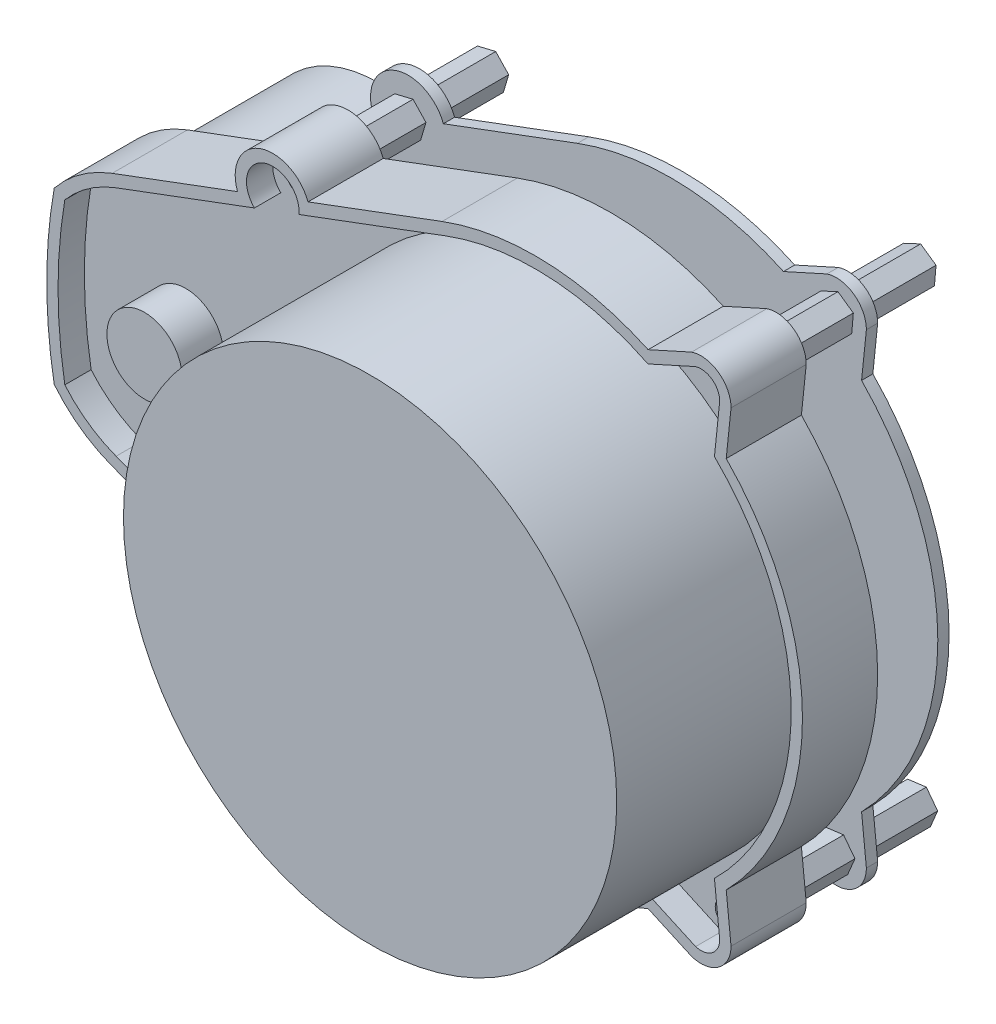
from build123d import *

# Parameters (mm, degrees)
ESQUISSE1_R             = 1.6
BOSS_EXTRU_1_DEPTH      = 10
ESQUISSE2_R             = 32.8
BOSS_EXTRU_2_DEPTH      = 22
ENL_V_MAT_EXTRU_1_DEPTH = 3.5
BOSS_EXTRU_3_REACH      = 79.261
ESQUISSE4_R             = 32.8
ESQUISSE5_R             = 16
BOSS_EXTRU_4_DEPTH      = 19
ESQUISSE6_R             = 1
BOSS_EXTRU_5_DEPTH      = 27
BOSS_EXTRU_6_DEPTH      = 1.5
ESQUISSE8_R             = 5
BOSS_EXTRU_7_DEPTH      = 5.5
SKETCH_1_W              = 183.813547174
SKETCH_1_H              = 124.067416174
CUT_EXTRUDE_1_DEPTH     = 18


with BuildPart() as part:
    # Esquisse1 → Boss.-Extru.1 (new body)
    with BuildSketch(Plane.XY):
        with BuildLine():
            ThreePointArc((-56.3, -16.861494596), (-60.528670487, -14.599558136), (-64.01, -11.301322931))
            ThreePointArc((-64.01, -11.301322931), (-65, 0), (-64.01, 11.301322931))
            ThreePointArc((-64.01, 11.301322931), (-60.528670487, 14.599558136), (-56.3, 16.861494596))
            Line((-56.3, 16.861494596), (-39.624688626, 23.091930519))
            ThreePointArc((-39.624688626, 23.091930519), (-36.690940127, 29.525679018), (-30.257191628, 26.591930519))
            Line((-30.257191628, 26.591930519), (-12.425, 33.254614341))
            ThreePointArc((-12.425, 33.254614341), (1.381675102, 35.473102119), (14.973963383, 32.187426436))
            Line((14.973963383, 32.187426436), (20.756023105, 34.801647207))
            ThreePointArc((20.756023105, 34.801647207), (24.347774736, 34.238511045), (26, 31))
            Line((26, 31), (25.359978077, 24.841930519))
            ThreePointArc((25.359978077, 24.841930519), (35.5, 0), (25.359978077, -24.841930519))
            Line((25.359978077, -24.841930519), (26, -31))
            ThreePointArc((26, -31), (24.347774736, -34.238511045), (20.756023105, -34.801647207))
            Line((20.756023105, -34.801647207), (14.973963383, -32.187426436))
            ThreePointArc((14.973963383, -32.187426436), (1.381675102, -35.473102119), (-12.425, -33.254614341))
            Line((-12.425, -33.254614341), (-30.257191628, -26.591930519))
            ThreePointArc((-30.257191628, -26.591930519), (-36.690940127, -29.525679018), (-39.624688626, -23.091930519))
            Line((-39.624688626, -23.091930519), (-56.3, -16.861494596))
        make_face()
        with Locations((-35, -25)):
            Circle(ESQUISSE1_R, mode=Mode.SUBTRACT)
        with Locations((22, 31)):
            Circle(ESQUISSE1_R, mode=Mode.SUBTRACT)
        with Locations((-35, 25)):
            Circle(ESQUISSE1_R, mode=Mode.SUBTRACT)
        with Locations((22, -31)):
            Circle(ESQUISSE1_R, mode=Mode.SUBTRACT)
    extrude(amount=BOSS_EXTRU_1_DEPTH)

    # Esquisse2 → Boss.-Extru.2 (add)
    with BuildSketch(Plane.XY.offset(10)):
        Circle(ESQUISSE2_R)
    extrude(amount=BOSS_EXTRU_2_DEPTH)

    # Esquisse3 → Enlèv. mat.-Extru.1 (cut)
    with BuildSketch(Plane.XY.offset(10)):
        with BuildLine():
            Line((-55.775, -15.456370046), (-37.378202776, -22.330008789))
            ThreePointArc((-37.378202776, -22.330008789), (-36.165940127, -28.120554469), (-31.453677478, -24.543603151))
            Line((-31.453677478, -24.543603151), (-11.9, -31.849489792))
            ThreePointArc((-11.9, -31.849489792), (1.664031028, -33.959255009), (14.956816294, -30.533484019))
            Line((14.956816294, -30.533484019), (21.291141631, -33.397398551))
            ThreePointArc((21.291141631, -33.397398551), (23.468656713, -33.023128137), (24.499056843, -31.06866508))
            Line((24.499056843, -31.06866508), (23.79417774, -24.286562245))
            ThreePointArc((23.79417774, -24.286562245), (34, 0), (23.79417774, 24.286562245))
            Line((23.79417774, 24.286562245), (24.499056843, 31.06866508))
            ThreePointArc((24.499056843, 31.06866508), (23.468656713, 33.023128137), (21.291141631, 33.397398551))
            Line((21.291141631, 33.397398551), (14.956816294, 30.533484019))
            ThreePointArc((14.956816294, 30.533484019), (1.664031028, 33.959255009), (-11.9, 31.849489792))
            Line((-11.9, 31.849489792), (-31.453677478, 24.543603151))
            ThreePointArc((-31.453677478, 24.543603151), (-36.165940127, 28.120554469), (-37.378202776, 22.330008789))
            Line((-37.378202776, 22.330008789), (-55.775, 15.456370046))
            ThreePointArc((-55.775, 15.456370046), (-59.496201473, 13.493411636), (-62.6, 10.653168543))
            ThreePointArc((-62.6, 10.653168543), (-63.5, 0), (-62.6, -10.653168543))
            ThreePointArc((-62.6, -10.653168543), (-59.496201473, -13.493411636), (-55.775, -15.456370046))
        make_face()
    extrude(amount=-ENL_V_MAT_EXTRU_1_DEPTH, mode=Mode.SUBTRACT)


with BuildPart() as enl_v_mat_extru_1_piece_1:
    # of the separate pieces the step leaves, piece 1, a body of its own (enl_v_mat_extru_1_pieces)
    add(part.part.solids().sort_by_distance((32.8, 0, 10))[0])


with BuildPart() as enl_v_mat_extru_1_piece_2:
    # of the separate pieces the step leaves, piece 2, a body of its own (enl_v_mat_extru_1_pieces)
    add(part.part.solids().sort_by_distance((-64.01, 11.301322931, 0))[0])

    # Esquisse4 → Boss.-Extru.3 (add, up to next)
    with BuildSketch(Plane(origin=(0, 0, 10), x_dir=(-1, 0, 0), z_dir=(0, 0, -1)), mode=Mode.PRIVATE) as boss_extru_3_sk1:
        with Locations(Location((0, 0, 0), (0, 0, 180))):
            Circle(ESQUISSE4_R)
    boss_extru_3_tool1 = extrude(boss_extru_3_sk1.sketch, amount=BOSS_EXTRU_3_REACH, mode=Mode.PRIVATE) - enl_v_mat_extru_1_piece_2.part

    add(enl_v_mat_extru_1_piece_1.part)  # Boss.-Extru.3 merges Enlèv. mat.-Extru.1 piece 1
    add(boss_extru_3_tool1.solids().sort_by_distance((0, 0, 10))[0])

    # Esquisse5 → Boss.-Extru.4 (add)
    with BuildSketch(Plane(origin=(0, 0, 0), x_dir=(-1, 0, 0), z_dir=(0, 0, -1))):
        with Locations(Location((50, 0, 0), (0, 0, 336.653490915))):
            Circle(ESQUISSE5_R)
    extrude(amount=BOSS_EXTRU_4_DEPTH)

    # Esquisse6 → Boss.-Extru.5 (add)
    # profile 1 of 4: a face of its own
    with BuildSketch(Plane(origin=(0, 0, 0), x_dir=(-1, 0, 0), z_dir=(0, 0, -1))):
        Polygon((-20.489225606, -29.008126327), (-22.969626005, -28.695694159), (-24.480400399, -30.687567832), (-23.510774394, -32.991873673), (-21.030373995, -33.304305841), (-19.519599601, -31.312432168), align=None)
        with Locations((-22, -31)):
            Circle(ESQUISSE6_R, mode=Mode.SUBTRACT)
    # profile 2 of 4: a face of its own
    with BuildSketch(Plane(origin=(0, 0, 0), x_dir=(-1, 0, 0), z_dir=(0, 0, -1))):
        Polygon((36.086835018, -22.748602735), (33.593650283, -22.933074633), (32.506815266, -25.184471898), (33.913164982, -27.251397265), (36.406349717, -27.066925367), (37.493184734, -24.815528102), align=None)
        with Locations((35, -25)):
            Circle(ESQUISSE6_R, mode=Mode.SUBTRACT)
    # profile 3 of 4: a face of its own
    with BuildSketch(Plane(origin=(0, 0, 0), x_dir=(-1, 0, 0), z_dir=(0, 0, -1))):
        Polygon((36.720274889, 26.814016072), (34.289153443, 27.396809791), (32.568878555, 25.582793719), (33.279725111, 23.185983928), (35.710846557, 22.603190209), (37.431121445, 24.417206281), align=None)
        with Locations((35, 25)):
            Circle(ESQUISSE6_R, mode=Mode.SUBTRACT)
    # profile 4 of 4: a face of its own
    with BuildSketch(Plane(origin=(0, 0, 0), x_dir=(-1, 0, 0), z_dir=(0, 0, -1))):
        Polygon((-19.952160425, 32.43399898), (-22.217959758, 33.490480585), (-24.265799333, 32.056481605), (-24.047839575, 29.56600102), (-21.782040242, 28.509519415), (-19.734200667, 29.943518395), align=None)
        with Locations((-22, 31)):
            Circle(ESQUISSE6_R, mode=Mode.SUBTRACT)
    extrude(amount=BOSS_EXTRU_5_DEPTH)

    # Esquisse7 → Boss.-Extru.6 (add)
    with BuildSketch(Plane(origin=(0, 0, -8), x_dir=(-1, 0, 0), z_dir=(0, 0, -1))):
        with BuildLine():
            Line((30.257191628, 26.591930519), (12.425, 33.254614341))
            ThreePointArc((12.425, 33.254614341), (-1.381675102, 35.473102119), (-14.973963383, 32.187426436))
            Line((-14.973963383, 32.187426436), (-20.756023105, 34.801647207))
            ThreePointArc((-20.756023105, 34.801647207), (-24.347774736, 34.238511045), (-26, 31))
            Line((-26, 31), (-25.359978077, 24.841930519))
            ThreePointArc((-25.359978077, 24.841930519), (-35.5, 0), (-25.359978077, -24.841930519))
            Line((-25.359978077, -24.841930519), (-26, -31))
            ThreePointArc((-26, -31), (-24.347774736, -34.238511045), (-20.756023105, -34.801647207))
            Line((-20.756023105, -34.801647207), (-14.973963383, -32.187426436))
            ThreePointArc((-14.973963383, -32.187426436), (-1.381675102, -35.473102119), (12.425, -33.254614341))
            Line((12.425, -33.254614341), (30.257191628, -26.591930519))
            ThreePointArc((30.257191628, -26.591930519), (36.690940127, -29.525679018), (39.624688626, -23.091930519))
            ThreePointArc((39.624688626, -23.091930519), (33.487603548, 0), (39.624688626, 23.091930519))
            ThreePointArc((39.624688626, 23.091930519), (36.690940127, 29.525679018), (30.257191628, 26.591930519))
        make_face()
    extrude(amount=BOSS_EXTRU_6_DEPTH)

    # Esquisse8 → Boss.-Extru.7 (add)
    with BuildSketch(Plane.XY.offset(6.5)):
        with Locations((-50, 0)):
            Circle(ESQUISSE8_R)
    extrude(amount=BOSS_EXTRU_7_DEPTH)

    # 草图1 → 切除-拉伸1 (cut)
    with BuildSketch(Plane(origin=(0, 0, -19), x_dir=(-1, 0, 0), z_dir=(0, 0, -1))):
        with Locations((14.308056493, -2.422140446)):
            Rectangle(SKETCH_1_W, SKETCH_1_H)
    extrude(amount=CUT_EXTRUDE_1_DEPTH, mode=Mode.SUBTRACT)


solid = enl_v_mat_extru_1_piece_2.part
